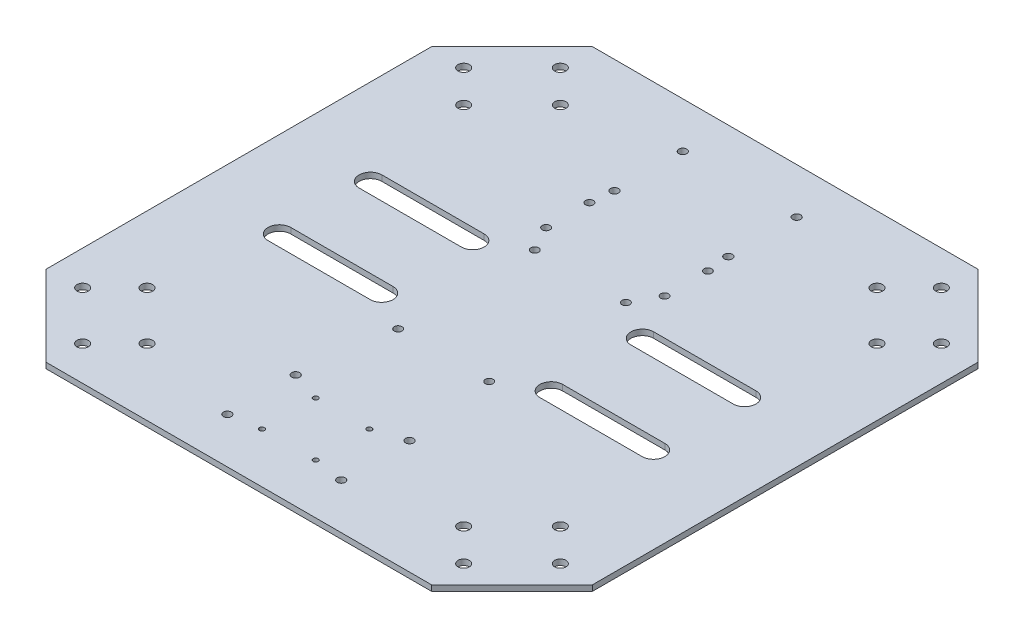
from build123d import *

# Parameters (mm, degrees)
BOSS_EXTRUDE1_DEPTH = 3.175
SKETCH2_R           = 3.175
CUT_EXTRUDE1_DEPTH  = 6.35
SKETCH3_R           = 2.159
CUT_EXTRUDE2_DEPTH  = 6.35
SKETCH4_R           = 2.2225
CUT_EXTRUDE3_DEPTH  = 351.937720963
SKETCH10_R          = 1.397
CUT_EXTRUDE4_DEPTH  = 351.937720963
SKETCH11_R          = 2.159
CUT_EXTRUDE6_DEPTH  = 351.937720963


with BuildPart() as part:
    # Sketch1 → Boss-Extrude1 (new body)
    with BuildSketch(Plane(origin=(0, 0, 0), x_dir=(1, 0, 0), z_dir=(0, 1, 0))):
        Polygon((-16.864769233, 51.656360067), (-61.766049839, 6.755079462), (-61.766049839, -208.242359328), (-16.864769233, -253.143639933), (198.132669556, -253.143639933), (243.033950161, -208.242359328), (243.033950161, 6.755079462), (198.132669556, 51.656360067), align=None)
        with BuildLine():
            ThreePointArc((43.337601054, -119.793639933), (49.687601054, -126.143639933), (43.337601054, -132.493639933))
            Line((43.337601054, -132.493639933), (-13.679235779, -132.493639933))
            ThreePointArc((-13.679235779, -132.493639933), (-20.029235779, -126.143639933), (-13.679235779, -119.793639933))
            Line((-13.679235779, -119.793639933), (43.337601054, -119.793639933))
        make_face(mode=Mode.SUBTRACT)
        with BuildLine():
            Line((194.947136102, -132.493639933), (137.930299269, -132.493639933))
            ThreePointArc((137.930299269, -132.493639933), (131.580299269, -126.143639933), (137.930299269, -119.793639933))
            Line((137.930299269, -119.793639933), (194.947136102, -119.793639933))
            ThreePointArc((194.947136102, -119.793639933), (201.297136102, -126.143639933), (194.947136102, -132.493639933))
        make_face(mode=Mode.SUBTRACT)
        with BuildLine():
            Line((-13.679235779, -68.993639933), (43.337601054, -68.993639933))
            ThreePointArc((43.337601054, -68.993639933), (49.687601054, -75.343639933), (43.337601054, -81.693639933))
            Line((43.337601054, -81.693639933), (-13.679235779, -81.693639933))
            ThreePointArc((-13.679235779, -81.693639933), (-20.029235779, -75.343639933), (-13.679235779, -68.993639933))
        make_face(mode=Mode.SUBTRACT)
        with BuildLine():
            ThreePointArc((137.930299269, -81.693639933), (131.580299269, -75.343639933), (137.930299269, -68.993639933))
            Line((137.930299269, -68.993639933), (194.947136102, -68.993639933))
            ThreePointArc((194.947136102, -68.993639933), (201.297136102, -75.343639933), (194.947136102, -81.693639933))
            Line((194.947136102, -81.693639933), (137.930299269, -81.693639933))
        make_face(mode=Mode.SUBTRACT)
    extrude(amount=BOSS_EXTRUDE1_DEPTH)

    # Sketch2 → Cut-Extrude1 (cut)
    with BuildSketch(Plane(origin=(0, 3.175, 0), x_dir=(1, 0, 0), z_dir=(0, 1, 0))):
        with Locations(Location((-15.627316695, 32.458395287, 0), (0, 0, 270))):
            Circle(SKETCH2_R)
        with Locations(Location((2.333195547, 14.497883045, 0), (0, 0, 270))):
            Circle(SKETCH2_R)
        with Locations(Location((-24.607572816, -12.442885319, 0), (0, 0, 270))):
            Circle(SKETCH2_R)
        with Locations(Location((-42.568085059, 5.517626924, 0), (0, 0, 270))):
            Circle(SKETCH2_R)
        with Locations(Location((205.875473139, -12.442885319, 0), (0, 0, 270))):
            Circle(SKETCH2_R)
        with Locations(Location((223.835985381, 5.517626924, 0), (0, 0, 270))):
            Circle(SKETCH2_R)
        with Locations(Location((178.934704776, 14.497883045, 0), (0, 0, 270))):
            Circle(SKETCH2_R)
        with Locations(Location((196.895217018, 32.458395287, 0), (0, 0, 270))):
            Circle(SKETCH2_R)
        with Locations(Location((-24.607572816, -189.044394548, 0), (0, 0, 270))):
            Circle(SKETCH2_R)
        with Locations(Location((-42.568085059, -207.00490679, 0), (0, 0, 270))):
            Circle(SKETCH2_R)
        with Locations(Location((-15.627316695, -233.945675153, 0), (0, 0, 270))):
            Circle(SKETCH2_R)
        with Locations(Location((2.333195547, -215.985162911, 0), (0, 0, 270))):
            Circle(SKETCH2_R)
        with Locations(Location((223.835985381, -207.00490679, 0), (0, 0, 270))):
            Circle(SKETCH2_R)
        with Locations(Location((196.895217018, -233.945675153, 0), (0, 0, 270))):
            Circle(SKETCH2_R)
        with Locations(Location((178.934704776, -215.985162911, 0), (0, 0, 270))):
            Circle(SKETCH2_R)
        with Locations(Location((205.875473139, -189.044394548, 0), (0, 0, 270))):
            Circle(SKETCH2_R)
    extrude(amount=-CUT_EXTRUDE1_DEPTH, mode=Mode.SUBTRACT)

    # Sketch3 → Cut-Extrude2 (cut)
    with BuildSketch(Plane(origin=(0, 3.175, 0), x_dir=(1, 0, 0), z_dir=(0, 1, 0))):
        with Locations(Location((65.233950161, -62.643639933, 0), (0, 0, 270))):
            Circle(SKETCH3_R)
        with Locations(Location((116.033950161, -62.643639933, 0), (0, 0, 270))):
            Circle(SKETCH3_R)
        with Locations(Location((65.233950161, -138.843639933, 0), (0, 0, 270))):
            Circle(SKETCH3_R)
        with Locations(Location((116.033950161, -138.843639933, 0), (0, 0, 270))):
            Circle(SKETCH3_R)
    extrude(amount=-CUT_EXTRUDE2_DEPTH, mode=Mode.SUBTRACT)

    # Sketch4 → Cut-Extrude3 (cut, through all)
    with BuildSketch(Plane(origin=(0, 3.175, 0), x_dir=(1, 0, 0), z_dir=(0, 1, 0))):
        with Locations(Location((58.883950161, 26.256360067, 0), (0, 0, 270))):
            Circle(SKETCH4_R)
        with Locations(Location((122.383950161, 26.256360067, 0), (0, 0, 270))):
            Circle(SKETCH4_R)
        with Locations(Location((58.883950161, -11.843639933, 0), (0, 0, 270))):
            Circle(SKETCH4_R)
        with Locations(Location((122.383950161, -11.843639933, 0), (0, 0, 270))):
            Circle(SKETCH4_R)
        with Locations(Location((122.383950161, -189.643639933, 0), (0, 0, 90))):
            Circle(SKETCH4_R)
        with Locations(Location((58.883950161, -189.643639933, 0), (0, 0, 90))):
            Circle(SKETCH4_R)
        with Locations(Location((122.383950161, -227.743639933, 0), (0, 0, 90))):
            Circle(SKETCH4_R)
        with Locations(Location((58.883950161, -227.743639933, 0), (0, 0, 90))):
            Circle(SKETCH4_R)
    extrude(amount=-CUT_EXTRUDE3_DEPTH, mode=Mode.SUBTRACT)

    # Sketch10 → Cut-Extrude4 (cut, through all)
    with BuildSketch(Plane(origin=(0, 0, 0), x_dir=(-1, 0, 0), z_dir=(0, -1, 0))):
        with Locations(Location((-105.619950161, -195.222402366, 0), (0, 0, 90))):
            Circle(SKETCH10_R)
        with Locations(Location((-105.619950161, -225.194402366, 0), (0, 0, 90))):
            Circle(SKETCH10_R)
        with Locations(Location((-75.647950161, -225.194402366, 0), (0, 0, 270))):
            Circle(SKETCH10_R)
        with Locations(Location((-75.647950161, -195.222402366, 0), (0, 0, 270))):
            Circle(SKETCH10_R)
    extrude(amount=-CUT_EXTRUDE4_DEPTH, mode=Mode.SUBTRACT)

    # Sketch11 → Cut-Extrude6 (cut, through all)
    with BuildSketch(Plane.XZ):
        with Locations(Location((123.653950161, 24.543639933, 0), (0, 0, 270))):
            Circle(SKETCH11_R)
        with Locations(Location((123.653950161, 48.673639933, 0), (0, 0, 90))):
            Circle(SKETCH11_R)
        with Locations(Location((57.613950161, 48.673639933, 0), (0, 0, 270))):
            Circle(SKETCH11_R)
        with Locations(Location((57.613950161, 24.543639933, 0), (0, 0, 90))):
            Circle(SKETCH11_R)
    extrude(amount=-CUT_EXTRUDE6_DEPTH, mode=Mode.SUBTRACT)


solid = part.part
